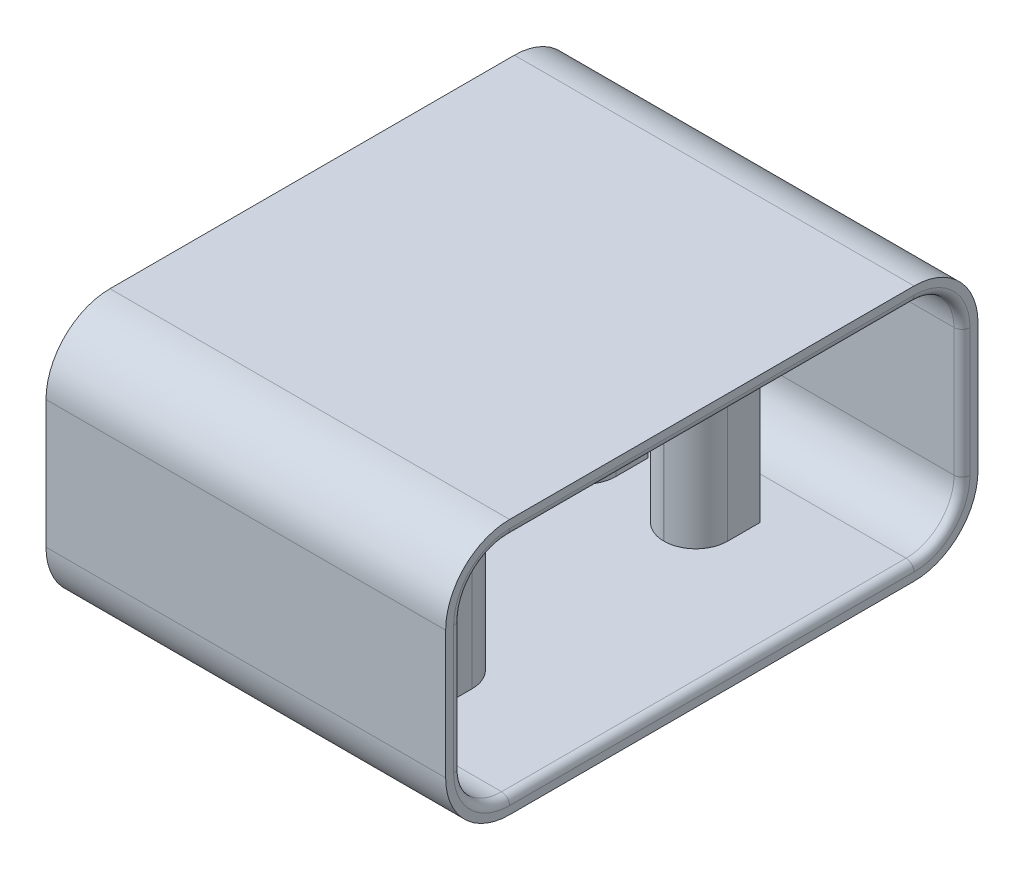
from build123d import *

# Parameters (mm, degrees)
FILLET1_R                       = 0.5
BOSS_EXTRUDE6_REACH             = 33.084
BOSS_EXTRUDE6_DIRECTION_2_REACH = 33.084
MIRROR2_COPY_1_REACH            = 33.084
MIRROR2_COPY_2_REACH            = 33.084
MIRROR2_COPY_3_REACH            = 33.084
MIRROR2_COPY_4_REACH            = 33.084


with BuildPart() as part:
    # Sweep1: sweep along a path in Sketch2path
    with BuildLine(Plane.XY) as sweep1_path:
        Line((0, 0), (25, 0))
    # Sketch3 → Sweep1 (sweep)
    with BuildSketch(Plane(origin=(0, 0, 0), x_dir=(0, 0, -1), z_dir=(1, 0, 0))):
        with BuildLine():
            Line((12.65, 8), (-12.65, 8))
            ThreePointArc((-12.65, 8), (-15.478427125, 6.828427125), (-16.65, 4))
            Line((-16.65, 4), (-16.65, -4))
            ThreePointArc((-16.65, -4), (-15.478427125, -6.828427125), (-12.65, -8))
            Line((-12.65, -8), (12.65, -8))
            ThreePointArc((12.65, -8), (15.478427125, -6.828427125), (16.65, -4))
            Line((16.65, -4), (16.65, 4))
            ThreePointArc((16.65, 4), (15.478427125, 6.828427125), (12.65, 8))
        make_face()
        with BuildLine():
            Line((-15.65, 4), (-15.65, -4))
            ThreePointArc((-15.65, -4), (-14.771320344, -6.121320344), (-12.65, -7))
            Line((-12.65, -7), (12.65, -7))
            ThreePointArc((12.65, -7), (14.771320344, -6.121320344), (15.65, -4))
            Line((15.65, -4), (15.65, 4))
            ThreePointArc((15.65, 4), (14.771320344, 6.121320344), (12.65, 7))
            Line((12.65, 7), (-12.65, 7))
            ThreePointArc((-12.65, 7), (-14.771320344, 6.121320344), (-15.65, 4))
        make_face(mode=Mode.SUBTRACT)
    sweep(path=sweep1_path.line)

    # Fillet1
    fillet1_edges = [part.edges().sort_by_distance(p)[0] for p in [
        (25, -6.121320344, 14.771320344),
        (25, 0, 15.65),
        (25, 6.121320344, 14.771320344),
        (25, 7, 0),
        (25, 6.121320344, -14.771320344),
        (25, 0, -15.65),
        (25, -6.121320344, -14.771320344),
        (0, -6.121320344, 14.771320344),
        (0, 0, 15.65),
        (0, 6.121320344, 14.771320344),
        (0, 7, 0),
        (0, 6.121320344, -14.771320344),
        (0, 0, -15.65),
        (0, -6.121320344, -14.771320344),
        (25, -7, 0),
        (0, -7, 0),
    ]]
    fillet(fillet1_edges, radius=FILLET1_R)

    # Sketch13 → Boss-Extrude6 (add, up to next)
    with BuildSketch(Plane(origin=(0, 0, 0), x_dir=(1, 0, 0), z_dir=(0, 1, 0)), mode=Mode.PRIVATE) as boss_extrude6_sk1:
        with BuildLine():
            Line((15.99, -6), (16.01, -6))
            ThreePointArc((16.01, -6), (17.417142495, -6.582857505), (18, -7.99))
            Line((18, -7.99), (18, -10))
            Line((18, -10), (14, -10))
            Line((14, -10), (14, -7.99))
            ThreePointArc((14, -7.99), (14.582857505, -6.582857505), (15.99, -6))
        make_face()
    boss_extrude6_tool1 = extrude(boss_extrude6_sk1.sketch, amount=BOSS_EXTRUDE6_REACH, mode=Mode.PRIVATE) - part.part
    boss_extrude6 = boss_extrude6_tool1.solids().sort_by_distance((16, 0, 8.184882))[0]
    add(boss_extrude6)

    # Sketch13 → Boss-Extrude6 direction 2 (add, up to next)
    with BuildSketch(Plane(origin=(0, 0, 0), x_dir=(1, 0, 0), z_dir=(0, 1, 0)), mode=Mode.PRIVATE) as boss_extrude6_direction_2_sk1:
        with BuildLine():
            Line((15.99, -6), (16.01, -6))
            ThreePointArc((16.01, -6), (17.417142495, -6.582857505), (18, -7.99))
            Line((18, -7.99), (18, -10))
            Line((18, -10), (14, -10))
            Line((14, -10), (14, -7.99))
            ThreePointArc((14, -7.99), (14.582857505, -6.582857505), (15.99, -6))
        make_face()
    boss_extrude6_direction_2_tool1 = extrude(boss_extrude6_direction_2_sk1.sketch, amount=-BOSS_EXTRUDE6_DIRECTION_2_REACH, mode=Mode.PRIVATE) - part.part
    boss_extrude6_direction_2 = boss_extrude6_direction_2_tool1.solids().sort_by_distance((16, 0, 8.184882))[0]
    add(boss_extrude6_direction_2)

    # Mirror1: Boss-Extrude6, Boss-Extrude6 direction 2 across plane
    add(boss_extrude6.mirror(Plane(origin=(12.5, 0, 0), x_dir=(0, 0, 1), z_dir=(1, 0, 0))))
    add(boss_extrude6_direction_2.mirror(Plane(origin=(12.5, 0, 0), x_dir=(0, 0, 1), z_dir=(1, 0, 0))))

    # Mirror2 copy 1 sketch → Mirror2 copy 1 (add, up to next)
    with BuildSketch(Plane(origin=(25, 0, 0), x_dir=(-1, 0, 0), z_dir=(0, 1, 0)), mode=Mode.PRIVATE) as mirror2_copy_1_sk1:
        with BuildLine():
            Line((15.99, -6), (16.01, -6))
            ThreePointArc((16.01, -6), (17.417142495, -6.582857505), (18, -7.99))
            Line((18, -7.99), (18, -10))
            Line((18, -10), (14, -10))
            Line((14, -10), (14, -7.99))
            ThreePointArc((14, -7.99), (14.582857505, -6.582857505), (15.99, -6))
        make_face()
    mirror2_copy_1_tool1 = extrude(mirror2_copy_1_sk1.sketch, amount=MIRROR2_COPY_1_REACH, mode=Mode.PRIVATE) - part.part
    add(mirror2_copy_1_tool1.solids().sort_by_distance((9, 0, -8.184882))[0])

    # Mirror2 copy 2 sketch → Mirror2 copy 2 (add, up to next)
    with BuildSketch(Plane(origin=(25, 0, 0), x_dir=(-1, 0, 0), z_dir=(0, 1, 0)), mode=Mode.PRIVATE) as mirror2_copy_2_sk1:
        with BuildLine():
            Line((15.99, -6), (16.01, -6))
            ThreePointArc((16.01, -6), (17.417142495, -6.582857505), (18, -7.99))
            Line((18, -7.99), (18, -10))
            Line((18, -10), (14, -10))
            Line((14, -10), (14, -7.99))
            ThreePointArc((14, -7.99), (14.582857505, -6.582857505), (15.99, -6))
        make_face()
    mirror2_copy_2_tool1 = extrude(mirror2_copy_2_sk1.sketch, amount=-MIRROR2_COPY_2_REACH, mode=Mode.PRIVATE) - part.part
    add(mirror2_copy_2_tool1.solids().sort_by_distance((9, 0, -8.184882))[0])

    # Mirror2 copy 3 sketch → Mirror2 copy 3 (add, up to next)
    with BuildSketch(Plane(origin=(0, 0, 0), x_dir=(1, 0, 0), z_dir=(0, 1, 0)), mode=Mode.PRIVATE) as mirror2_copy_3_sk1:
        with BuildLine():
            Line((15.99, 6), (16.01, 6))
            ThreePointArc((16.01, 6), (17.417142495, 6.582857505), (18, 7.99))
            Line((18, 7.99), (18, 10))
            Line((18, 10), (14, 10))
            Line((14, 10), (14, 7.99))
            ThreePointArc((14, 7.99), (14.582857505, 6.582857505), (15.99, 6))
        make_face()
    mirror2_copy_3_tool1 = extrude(mirror2_copy_3_sk1.sketch, amount=MIRROR2_COPY_3_REACH, mode=Mode.PRIVATE) - part.part
    add(mirror2_copy_3_tool1.solids().sort_by_distance((16, 0, -8.184882))[0])

    # Mirror2 copy 4 sketch → Mirror2 copy 4 (add, up to next)
    with BuildSketch(Plane(origin=(0, 0, 0), x_dir=(1, 0, 0), z_dir=(0, 1, 0)), mode=Mode.PRIVATE) as mirror2_copy_4_sk1:
        with BuildLine():
            Line((15.99, 6), (16.01, 6))
            ThreePointArc((16.01, 6), (17.417142495, 6.582857505), (18, 7.99))
            Line((18, 7.99), (18, 10))
            Line((18, 10), (14, 10))
            Line((14, 10), (14, 7.99))
            ThreePointArc((14, 7.99), (14.582857505, 6.582857505), (15.99, 6))
        make_face()
    mirror2_copy_4_tool1 = extrude(mirror2_copy_4_sk1.sketch, amount=-MIRROR2_COPY_4_REACH, mode=Mode.PRIVATE) - part.part
    add(mirror2_copy_4_tool1.solids().sort_by_distance((16, 0, -8.184882))[0])


solid = part.part
